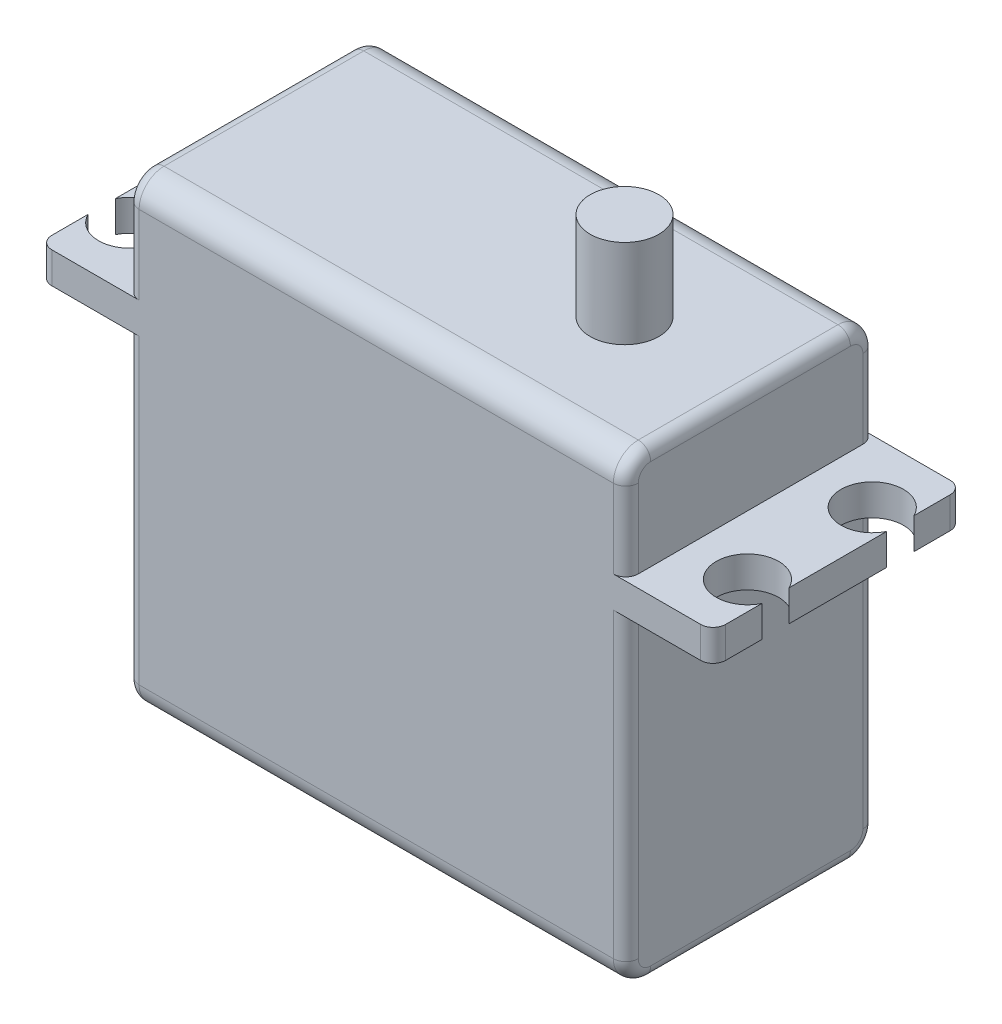
from build123d import *

# Parameters (mm, degrees)
SKETCH2_W           = 40
SKETCH2_H           = 20
BOSS_EXTRUDE1_DEPTH = 37
SKETCH3_W           = 20
SKETCH3_H           = 2.5
BOSS_EXTRUDE2_DEPTH = 7
SKETCH4_R           = 2.5
CUT_EXTRUDE5_DEPTH  = 7.25
SKETCH5_R           = 2.75
BOSS_EXTRUDE4_DEPTH = 7.1
FILLET1_R           = 2
FILLET2_R           = 1


with BuildPart() as part:
    # Sketch2 → Boss-Extrude1 (new body)
    with BuildSketch(Plane(origin=(0, 0, 0), x_dir=(1, 0, 0), z_dir=(0, 1, 0))):
        with Locations((20, 10)):
            Rectangle(SKETCH2_W, SKETCH2_H)
    extrude(amount=BOSS_EXTRUDE1_DEPTH)

    # Sketch3 → Boss-Extrude2 (add)
    with BuildSketch(Plane.ZY):
        with Locations((-10, 27.45)):
            Rectangle(SKETCH3_W, SKETCH3_H)
    boss_extrude2 = extrude(amount=BOSS_EXTRUDE2_DEPTH)

    # Mirror1: Boss-Extrude2 across plane
    add(boss_extrude2.mirror(Plane.ZY.offset(-20)))

    # Sketch4 → Cut-Extrude5 (cut)
    with BuildSketch(Plane(origin=(0, 28.7, 0), x_dir=(1, 0, 0), z_dir=(0, 1, 0))):
        with Locations((-4.75, 15)):
            Circle(SKETCH4_R)
        with Locations((-4.75, 5)):
            Circle(SKETCH4_R)
        with Locations((44.75, 5)):
            Circle(SKETCH4_R)
        with Locations((44.75, 15)):
            Circle(SKETCH4_R)
    extrude(amount=-CUT_EXTRUDE5_DEPTH, mode=Mode.SUBTRACT)

    # Sketch5 → Boss-Extrude4 (add)
    with BuildSketch(Plane(origin=(0, 37, 0), x_dir=(1, 0, 0), z_dir=(0, 1, 0))):
        with Locations(Location((29.9, 10, 0), (0, 0, 90))):
            Circle(SKETCH5_R)
    extrude(amount=BOSS_EXTRUDE4_DEPTH)

    # Fillet1
    fillet1_edges = [part.edges().sort_by_distance(p)[0] for p in [
        (20, 37, -20),
        (20, 0, -20),
        (20, 0, 0),
        (20, 37, 0),
    ]]
    fillet(fillet1_edges, radius=FILLET1_R)

    # Fillet2
    fillet2_edges = [part.edges().sort_by_distance(p)[0] for p in [
        (0, 31.85, -20),
        (0, 36.414213562, -19.414213562),
        (0, 36.414213562, -0.585786438),
        (40, 0, -10),
        (40, 0.585786438, -19.414213562),
        (40, 0.585786438, -0.585786438),
        (0, 0, -10),
        (0, 0.585786438, -19.414213562),
        (0, 0.585786438, -0.585786438),
        (0, 14.1, 0),
        (0, 14.1, -20),
        (-7, 27.45, -20),
        (-7, 27.45, 0),
        (40, 14.1, -20),
        (40, 14.1, 0),
        (47, 27.45, -20),
        (47, 27.45, 0),
        (0, 37, -10),
        (40, 37, -10),
        (40, 31.85, 0),
        (40, 31.85, -20),
        (40, 36.414213562, -19.414213562),
        (40, 36.414213562, -0.585786438),
        (0, 31.85, 0),
    ]]
    fillet(fillet2_edges, radius=FILLET2_R)


solid = part.part
